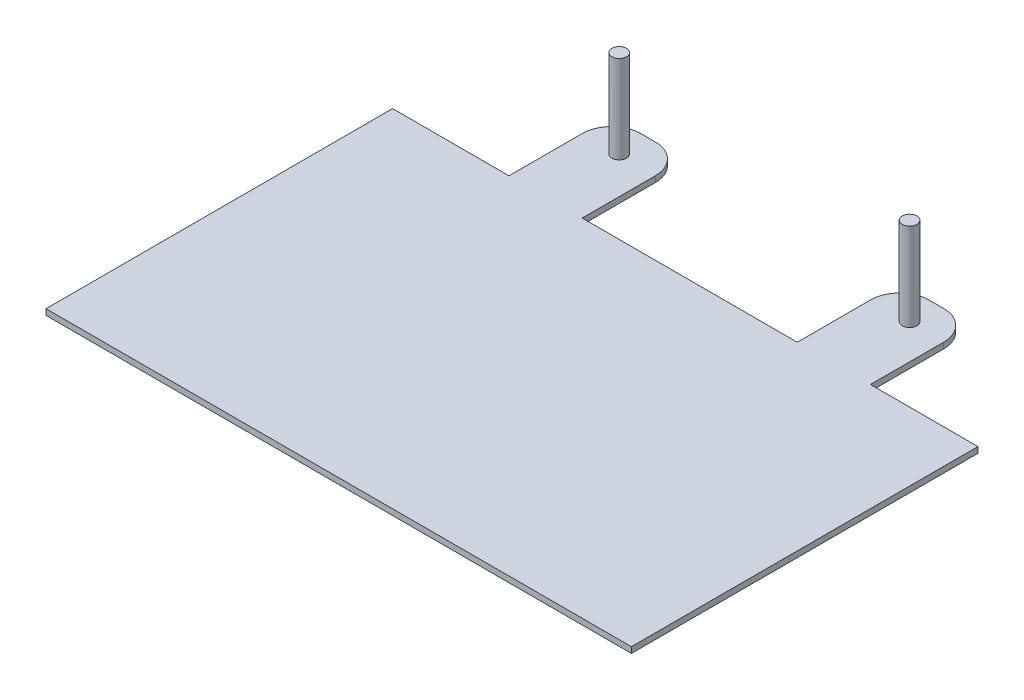
from build123d import *

# Parameters (mm, degrees)
EXTRUDE_1_DEPTH = 2
SKETCH_2_R      = 2.5
EXTRUDE_2_DEPTH = 30


with BuildPart() as part:
    # 草图1 → 凸台-拉伸1 (new body)
    with BuildSketch(Plane(origin=(0, 0, 0), x_dir=(1, 0, 0), z_dir=(0, 1, 0))):
        with BuildLine():
            Line((64.772727273, 118.409090909), (138.257575758, 118.409090909))
            Line((138.257575758, 118.409090909), (138.257575758, 143.409090909))
            ThreePointArc((138.257575758, 143.409090909), (141.186507946, 150.480158721), (148.257575758, 153.409090909))
            Line((148.257575758, 153.409090909), (153.257575758, 153.409090909))
            ThreePointArc((153.257575758, 153.409090909), (160.328643569, 150.480158721), (163.257575758, 143.409090909))
            Line((163.257575758, 143.409090909), (163.257575758, 118.409090909))
            Line((163.257575758, 118.409090909), (200, 118.409090909))
            Line((200, 118.409090909), (200, 0))
            Line((200, 0), (0, 0))
            Line((0, 0), (0, 118.409090909))
            Line((0, 118.409090909), (39.772727273, 118.409090909))
            Line((39.772727273, 118.409090909), (39.772727273, 143.409090909))
            ThreePointArc((39.772727273, 143.409090909), (42.701659461, 150.480158721), (49.772727273, 153.409090909))
            Line((49.772727273, 153.409090909), (54.772727273, 153.409090909))
            ThreePointArc((54.772727273, 153.409090909), (61.843795085, 150.480158721), (64.772727273, 143.409090909))
            Line((64.772727273, 143.409090909), (64.772727273, 118.409090909))
        make_face()
    extrude(amount=EXTRUDE_1_DEPTH)

    # 草图2 → 凸台-拉伸2 (add)
    with BuildSketch(Plane(origin=(0, 2, 0), x_dir=(1, 0, 0), z_dir=(0, 1, 0))):
        with Locations(Location((52.11924037, 143.695636013, 0), (0, 0, 90))):
            Circle(SKETCH_2_R)
        with Locations(Location((151.328174324, 143.695636013, 0), (0, 0, 90))):
            Circle(SKETCH_2_R)
    extrude(amount=EXTRUDE_2_DEPTH)


solid = part.part
